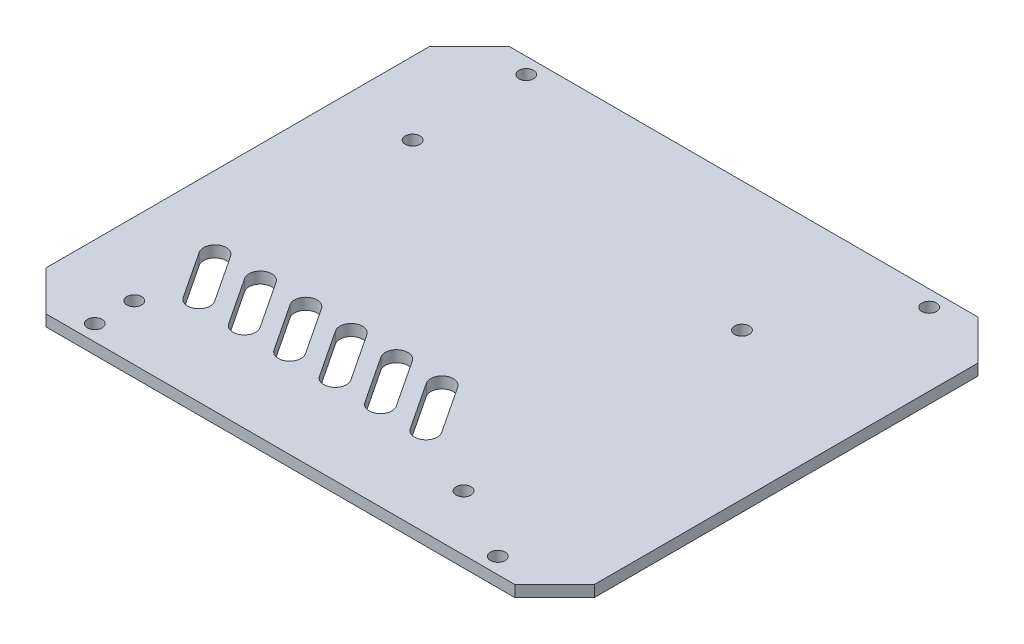
from build123d import *

# Parameters (mm, degrees)
EXTRUDE_1_DEPTH     = 2
CUT_EXTRUDE_1_REACH = 72.175
SKETCH_2_R          = 1.3
CUT_EXTRUDE_2_REACH = 72.175
SKETCH_3_R          = 1.3
CUT_EXTRUDE_3_REACH = 72.175


with BuildPart() as part:
    # 草图1 → 凸台-拉伸1 (new body)
    with BuildSketch(Plane.XZ.offset(19.39)):
        Polygon((-51.8, -40.295836944), (-44.795836944, -47.3), (37.795836944, -47.3), (44.8, -40.295836944), (44.8, 27.295836944), (37.795836944, 34.3), (-44.795836944, 34.3), (-51.8, 27.295836944), align=None)
    extrude(amount=EXTRUDE_1_DEPTH)

    # 草图2 → 切除-拉伸1 (cut, up to next)
    with BuildSketch(Plane.XZ.offset(21.39), mode=Mode.PRIVATE) as cut_extrude_1_sk1:
        with Locations(Location((-39.011567772, -24.5, 0), (0, 0, 270))):
            Circle(SKETCH_2_R)
    cut_extrude_1_tool1 = extrude(cut_extrude_1_sk1.sketch, amount=-CUT_EXTRUDE_1_REACH, mode=Mode.PRIVATE) & part.part
    # 草图2 → 切除-拉伸1 (cut, up to next)
    with BuildSketch(Plane.XZ.offset(21.39), mode=Mode.PRIVATE) as cut_extrude_1_sk2:
        with Locations(Location((19, -24.5, 0), (0, 0, 270))):
            Circle(SKETCH_2_R)
    cut_extrude_1_tool2 = extrude(cut_extrude_1_sk2.sketch, amount=-CUT_EXTRUDE_1_REACH, mode=Mode.PRIVATE) & part.part
    # 草图2 → 切除-拉伸1 (cut, up to next)
    with BuildSketch(Plane.XZ.offset(21.39), mode=Mode.PRIVATE) as cut_extrude_1_sk3:
        with Locations(Location((-39.011567772, 24.535212594, 0), (0, 0, 270))):
            Circle(SKETCH_2_R)
    cut_extrude_1_tool3 = extrude(cut_extrude_1_sk3.sketch, amount=-CUT_EXTRUDE_1_REACH, mode=Mode.PRIVATE) & part.part
    # 草图2 → 切除-拉伸1 (cut, up to next)
    with BuildSketch(Plane.XZ.offset(21.39), mode=Mode.PRIVATE) as cut_extrude_1_sk4:
        with Locations(Location((19, 24.535212594, 0), (0, 0, 270))):
            Circle(SKETCH_2_R)
    cut_extrude_1_tool4 = extrude(cut_extrude_1_sk4.sketch, amount=-CUT_EXTRUDE_1_REACH, mode=Mode.PRIVATE) & part.part
    add(cut_extrude_1_tool1.solids().sort_by_distance((-39.011568, -21.39, -24.5))[0], mode=Mode.SUBTRACT)
    add(cut_extrude_1_tool2.solids().sort_by_distance((19, -21.39, -24.5))[0], mode=Mode.SUBTRACT)
    add(cut_extrude_1_tool3.solids().sort_by_distance((-39.011568, -21.39, 24.535213))[0], mode=Mode.SUBTRACT)
    add(cut_extrude_1_tool4.solids().sort_by_distance((19, -21.39, 24.535213))[0], mode=Mode.SUBTRACT)

    # 草图3 → 切除-拉伸2 (cut, up to next)
    with BuildSketch(Plane.XZ.offset(21.39), mode=Mode.PRIVATE) as cut_extrude_2_sk1:
        with Locations(Location((32, -44.5, 0), (0, 0, 270))):
            Circle(SKETCH_3_R)
    cut_extrude_2_tool1 = extrude(cut_extrude_2_sk1.sketch, amount=-CUT_EXTRUDE_2_REACH, mode=Mode.PRIVATE) & part.part
    # 草图3 → 切除-拉伸2 (cut, up to next)
    with BuildSketch(Plane.XZ.offset(21.39), mode=Mode.PRIVATE) as cut_extrude_2_sk2:
        with Locations(Location((-39, -44.5, 0), (0, 0, 270))):
            Circle(SKETCH_3_R)
    cut_extrude_2_tool2 = extrude(cut_extrude_2_sk2.sketch, amount=-CUT_EXTRUDE_2_REACH, mode=Mode.PRIVATE) & part.part
    # 草图3 → 切除-拉伸2 (cut, up to next)
    with BuildSketch(Plane.XZ.offset(21.39), mode=Mode.PRIVATE) as cut_extrude_2_sk3:
        with Locations(Location((32, 31.5, 0), (0, 0, 270))):
            Circle(SKETCH_3_R)
    cut_extrude_2_tool3 = extrude(cut_extrude_2_sk3.sketch, amount=-CUT_EXTRUDE_2_REACH, mode=Mode.PRIVATE) & part.part
    # 草图3 → 切除-拉伸2 (cut, up to next)
    with BuildSketch(Plane.XZ.offset(21.39), mode=Mode.PRIVATE) as cut_extrude_2_sk4:
        with Locations(Location((-39, 31.5, 0), (0, 0, 270))):
            Circle(SKETCH_3_R)
    cut_extrude_2_tool4 = extrude(cut_extrude_2_sk4.sketch, amount=-CUT_EXTRUDE_2_REACH, mode=Mode.PRIVATE) & part.part
    add(cut_extrude_2_tool1.solids().sort_by_distance((32, -21.39, -44.5))[0], mode=Mode.SUBTRACT)
    add(cut_extrude_2_tool2.solids().sort_by_distance((-39, -21.39, -44.5))[0], mode=Mode.SUBTRACT)
    add(cut_extrude_2_tool3.solids().sort_by_distance((32, -21.39, 31.5))[0], mode=Mode.SUBTRACT)
    add(cut_extrude_2_tool4.solids().sort_by_distance((-39, -21.39, 31.5))[0], mode=Mode.SUBTRACT)

    # 草图4 → 切除-拉伸3 (cut, up to next)
    with BuildSketch(Plane.XZ.offset(21.39), mode=Mode.PRIVATE) as cut_extrude_3_sk1:
        with BuildLine():
            Line((-40.69671065, 11.402772719), (-35.182847057, 19.74527284))
            ThreePointArc((-35.182847057, 19.74527284), (-32.411574314, 20.311000146), (-31.845847008, 17.539727403))
            Line((-31.845847008, 17.539727403), (-37.359710601, 9.197227281))
            ThreePointArc((-37.359710601, 9.197227281), (-40.130983344, 8.631499976), (-40.69671065, 11.402772719))
        make_face()
    cut_extrude_3_tool1 = extrude(cut_extrude_3_sk1.sketch, amount=-CUT_EXTRUDE_3_REACH, mode=Mode.PRIVATE) & part.part
    # 草图4 → 切除-拉伸3 (cut, up to next)
    with BuildSketch(Plane.XZ.offset(21.39), mode=Mode.PRIVATE) as cut_extrude_3_sk2:
        with BuildLine():
            Line((-32.69671065, 11.402772719), (-27.182847057, 19.74527284))
            ThreePointArc((-27.182847057, 19.74527284), (-24.411574314, 20.311000146), (-23.845847008, 17.539727403))
            Line((-23.845847008, 17.539727403), (-29.359710601, 9.197227281))
            ThreePointArc((-29.359710601, 9.197227281), (-32.130983344, 8.631499976), (-32.69671065, 11.402772719))
        make_face()
    cut_extrude_3_tool2 = extrude(cut_extrude_3_sk2.sketch, amount=-CUT_EXTRUDE_3_REACH, mode=Mode.PRIVATE) & part.part
    # 草图4 → 切除-拉伸3 (cut, up to next)
    with BuildSketch(Plane.XZ.offset(21.39), mode=Mode.PRIVATE) as cut_extrude_3_sk3:
        with BuildLine():
            Line((-24.69671065, 11.402772719), (-19.182847057, 19.74527284))
            ThreePointArc((-19.182847057, 19.74527284), (-16.411574314, 20.311000146), (-15.845847008, 17.539727403))
            Line((-15.845847008, 17.539727403), (-21.359710601, 9.197227281))
            ThreePointArc((-21.359710601, 9.197227281), (-24.130983344, 8.631499976), (-24.69671065, 11.402772719))
        make_face()
    cut_extrude_3_tool3 = extrude(cut_extrude_3_sk3.sketch, amount=-CUT_EXTRUDE_3_REACH, mode=Mode.PRIVATE) & part.part
    # 草图4 → 切除-拉伸3 (cut, up to next)
    with BuildSketch(Plane.XZ.offset(21.39), mode=Mode.PRIVATE) as cut_extrude_3_sk4:
        with BuildLine():
            Line((-16.69671065, 11.402772719), (-11.182847057, 19.74527284))
            ThreePointArc((-11.182847057, 19.74527284), (-8.411574314, 20.311000146), (-7.845847008, 17.539727403))
            Line((-7.845847008, 17.539727403), (-13.359710601, 9.197227281))
            ThreePointArc((-13.359710601, 9.197227281), (-16.130983344, 8.631499976), (-16.69671065, 11.402772719))
        make_face()
    cut_extrude_3_tool4 = extrude(cut_extrude_3_sk4.sketch, amount=-CUT_EXTRUDE_3_REACH, mode=Mode.PRIVATE) & part.part
    # 草图4 → 切除-拉伸3 (cut, up to next)
    with BuildSketch(Plane.XZ.offset(21.39), mode=Mode.PRIVATE) as cut_extrude_3_sk5:
        with BuildLine():
            Line((-8.69671065, 11.402772719), (-3.182847057, 19.74527284))
            ThreePointArc((-3.182847057, 19.74527284), (-0.411574314, 20.311000146), (0.154152992, 17.539727403))
            Line((0.154152992, 17.539727403), (-5.359710601, 9.197227281))
            ThreePointArc((-5.359710601, 9.197227281), (-8.130983344, 8.631499976), (-8.69671065, 11.402772719))
        make_face()
    cut_extrude_3_tool5 = extrude(cut_extrude_3_sk5.sketch, amount=-CUT_EXTRUDE_3_REACH, mode=Mode.PRIVATE) & part.part
    # 草图4 → 切除-拉伸3 (cut, up to next)
    with BuildSketch(Plane.XZ.offset(21.39), mode=Mode.PRIVATE) as cut_extrude_3_sk6:
        with BuildLine():
            Line((-0.69671065, 11.402772719), (4.817152943, 19.74527284))
            ThreePointArc((4.817152943, 19.74527284), (7.588425686, 20.311000146), (8.154152992, 17.539727403))
            Line((8.154152992, 17.539727403), (2.640289399, 9.197227281))
            ThreePointArc((2.640289399, 9.197227281), (-0.130983344, 8.631499976), (-0.69671065, 11.402772719))
        make_face()
    cut_extrude_3_tool6 = extrude(cut_extrude_3_sk6.sketch, amount=-CUT_EXTRUDE_3_REACH, mode=Mode.PRIVATE) & part.part
    add(cut_extrude_3_tool1.solids().sort_by_distance((-36.271279, -21.39, 14.47125))[0], mode=Mode.SUBTRACT)
    add(cut_extrude_3_tool2.solids().sort_by_distance((-28.271279, -21.39, 14.47125))[0], mode=Mode.SUBTRACT)
    add(cut_extrude_3_tool3.solids().sort_by_distance((-20.271279, -21.39, 14.47125))[0], mode=Mode.SUBTRACT)
    add(cut_extrude_3_tool4.solids().sort_by_distance((-12.271279, -21.39, 14.47125))[0], mode=Mode.SUBTRACT)
    add(cut_extrude_3_tool5.solids().sort_by_distance((-4.271279, -21.39, 14.47125))[0], mode=Mode.SUBTRACT)
    add(cut_extrude_3_tool6.solids().sort_by_distance((3.728721, -21.39, 14.47125))[0], mode=Mode.SUBTRACT)


solid = part.part
